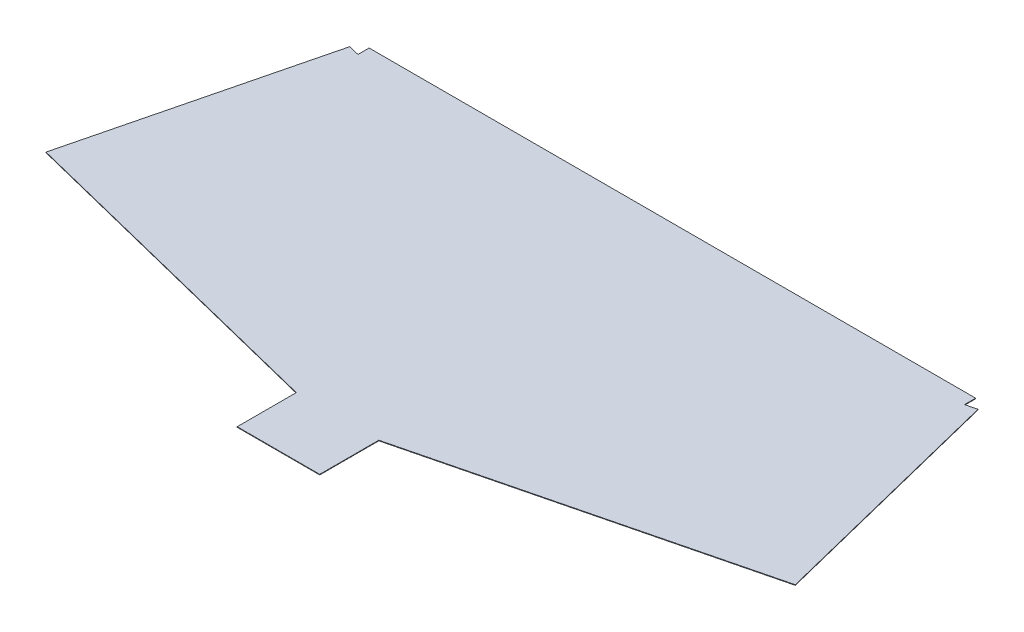
from build123d import *

# Parameters (mm, degrees)
SKETCH1_W           = 148
SKETCH1_H           = 106
SKETCH1_W_2         = 1088
SKETCH1_H_2         = 20
BOSS_EXTRUDE1_DEPTH = 1


with BuildPart() as part:
    # Sketch1 → Boss-Extrude1 (new body)
    with BuildSketch(Plane(origin=(0, 0, 0), x_dir=(1, 0, 0), z_dir=(0, 1, 0))):
        Polygon((-284.309741609, -519.73309486), (294.379685644, -375.483559699), (185.690258391, 60.9163871), align=None)
        with Locations((-358.309741609, -572.73309486)):
            Rectangle(SKETCH1_W, SKETCH1_H)
        Polygon((294.379685644, -375.483559699), (313.786824034, -370.650033087), (205.097396781, 65.749913711), (185.690258391, 60.9163871), align=None)
        with Locations((-358.309741609, 70.9163871)):
            Rectangle(SKETCH1_W_2, SKETCH1_H_2)
        Polygon((-902.309741609, 60.9163871), (-921.71688, 65.749913711), (-1030.406307253, -370.650033087), (-1010.999168863, -375.483559699), align=None)
        Polygon((-1010.999168863, -375.483559699), (-902.309741609, 60.9163871), (-432.309741609, -519.73309486), align=None)
        Polygon((185.690258391, 60.9163871), (-284.309741609, -519.73309486), (-432.309741609, -519.73309486), (-902.309741609, 60.9163871), align=None)
    extrude(amount=BOSS_EXTRUDE1_DEPTH)


solid = part.part
